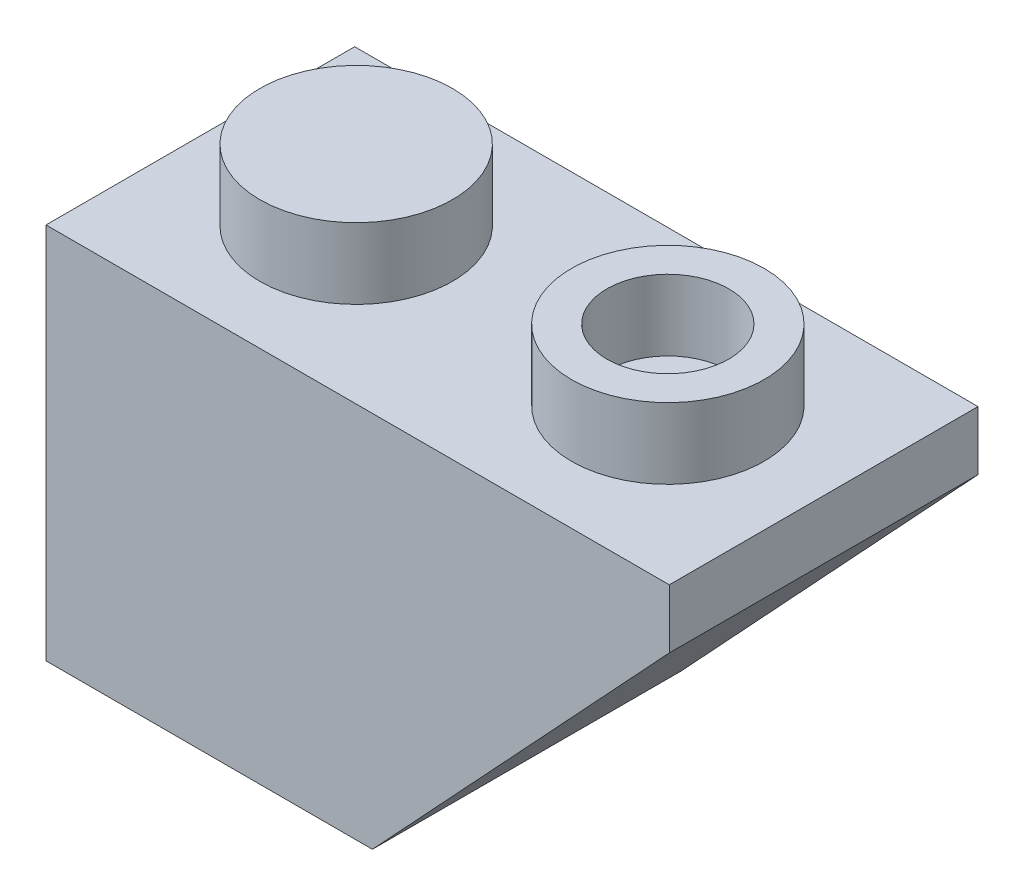
from build123d import *

# Parameters (mm, degrees)
BOSS_EXTRUDE1_DEPTH = 7.85
SKETCH5_W           = 5.3
SKETCH5_H           = 4.85
CUT_EXTRUDE1_DEPTH  = 8.1
SKETCH6_R           = 2.45
SKETCH6_R_2         = 1.55
BOSS_EXTRUDE3_DEPTH = 1.8
SKETCH7_R           = 0.95
CUT_EXTRUDE2_DEPTH  = 1.8


with BuildPart() as part:
    # Sketch2 → Boss-Extrude1 (new body)
    with BuildSketch(Plane.XY):
        Polygon((0, 9.6), (0, 0), (8.3, 0), (15.85, 8.1), (15.85, 9.6), align=None)
    extrude(amount=-BOSS_EXTRUDE1_DEPTH)

    # Sketch5 → Cut-Extrude1 (cut)
    with BuildSketch(Plane.XZ):
        with Locations((4.15, -3.925)):
            Rectangle(SKETCH5_W, SKETCH5_H)
    extrude(amount=-CUT_EXTRUDE1_DEPTH, mode=Mode.SUBTRACT)

    # Sketch6 → Boss-Extrude3 (add)
    # profile 1 of 2: a face of its own
    with BuildSketch(Plane(origin=(0, 9.6, 0), x_dir=(1, 0, 0), z_dir=(0, 1, 0))):
        with Locations(Location((3.9625, 3.925, 0), (0, 0, 270))):
            Circle(SKETCH6_R)
    # profile 2 of 2: a face of its own
    with BuildSketch(Plane(origin=(0, 9.6, 0), x_dir=(1, 0, 0), z_dir=(0, 1, 0))):
        with Locations(Location((11.8875, 3.925, 0), (0, 0, 270))):
            Circle(SKETCH6_R)
        with Locations(Location((11.8875, 3.925, 0), (0, 0, 270))):
            Circle(SKETCH6_R_2, mode=Mode.SUBTRACT)
    extrude(amount=BOSS_EXTRUDE3_DEPTH)

    # Sketch7 → Cut-Extrude2 (cut)
    with BuildSketch(Plane.XZ.offset(-8.1)):
        with Locations(Location((3.9625, -3.925, 0), (0, 0, 270))):
            Circle(SKETCH7_R)
    extrude(amount=-CUT_EXTRUDE2_DEPTH, mode=Mode.SUBTRACT)


solid = part.part
